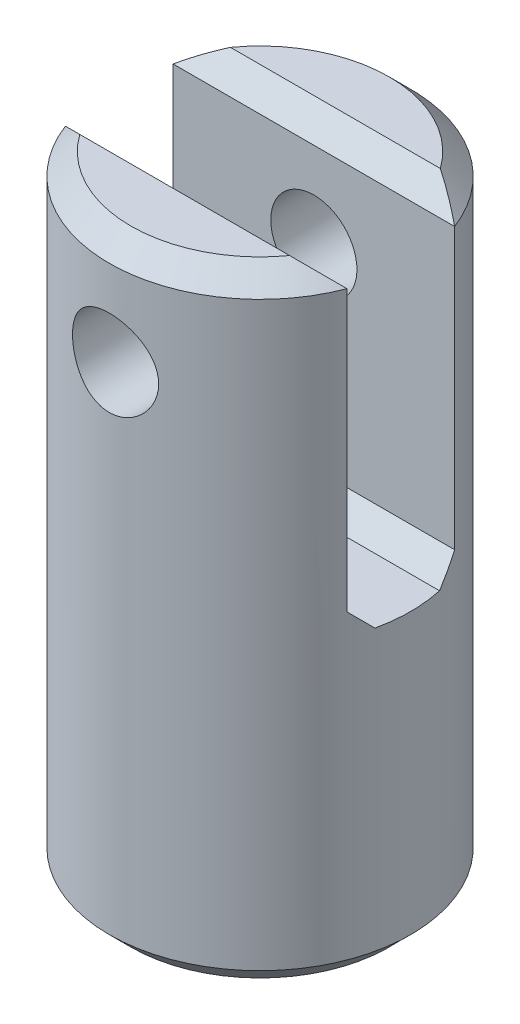
from build123d import *

# Parameters (mm, degrees)
ESBO_O1_R                  = 7
RESSALTO_EXTRUS_O1_DEPTH   = 14.5
CORTE_EXTRUS_O1_DEPTH      = 18.557049866
CORTE_EXTRUS_O1_DEPTH_BACK = 18.557049866
ESBO_O2_W                  = 5
ESBO_O2_H                  = 15
CORTE_EXTRUS_O2_DEPTH      = 18.557049866
CORTE_EXTRUS_O2_DEPTH_BACK = 18.557049866
ESBO_O3_R                  = 2
CHANFRO1_SIZE              = 1
CHANFRO2_SIZE              = 1


with BuildPart() as part:
    # Esboço1 → Ressalto-extrusão1 (new, symmetric)
    with BuildSketch(Plane(origin=(0, 0, 0), x_dir=(1, 0, 0), z_dir=(0, 1, 0))):
        with Locations(Location((0, 0, 0), (0, 0, 90))):
            Circle(ESBO_O1_R)
    extrude(amount=RESSALTO_EXTRUS_O1_DEPTH, both=True)

    # Esboço2 → Corte-extrusão1 (cut, two sides: drawn at the far end of the back side and taken through both)
    with BuildSketch(Plane(origin=(0, 0, 0), x_dir=(0, 0, -1), z_dir=(1, 0, 0)).offset(-CORTE_EXTRUS_O1_DEPTH_BACK)):
        with Locations((0, 7)):
            Rectangle(ESBO_O2_W, ESBO_O2_H)
    extrude(amount=CORTE_EXTRUS_O1_DEPTH + CORTE_EXTRUS_O1_DEPTH_BACK, mode=Mode.SUBTRACT)

    # Esboço3 → Corte-extrusão2 (cut, two sides: drawn at the far end of the back side and taken through both)
    with BuildSketch(Plane.XY.offset(-CORTE_EXTRUS_O2_DEPTH_BACK)):
        with Locations(Location((0, 9.5, 0), (0, 0, 90))):
            Circle(ESBO_O3_R)
    extrude(amount=CORTE_EXTRUS_O2_DEPTH + CORTE_EXTRUS_O2_DEPTH_BACK, mode=Mode.SUBTRACT)

    # Chanfro1
    chanfro1_edges = [part.edges().sort_by_distance(p)[0] for p in [
        (0, -14.5, 7),
    ]]
    chamfer(chanfro1_edges, length=CHANFRO1_SIZE)

    # Chanfro2
    chanfro2_edges = [part.edges().sort_by_distance(p)[0] for p in [
        (0, -0.5, -2.5),
        (0, -0.5, 2.5),
        (3.968626967, 14.5, -5.766281297),
        (0, 14.5, 7),
        (0, 14.5, -2.5),
        (0, 14.5, 2.5),
    ]]
    chamfer(chanfro2_edges, length=CHANFRO2_SIZE)


solid = part.part
